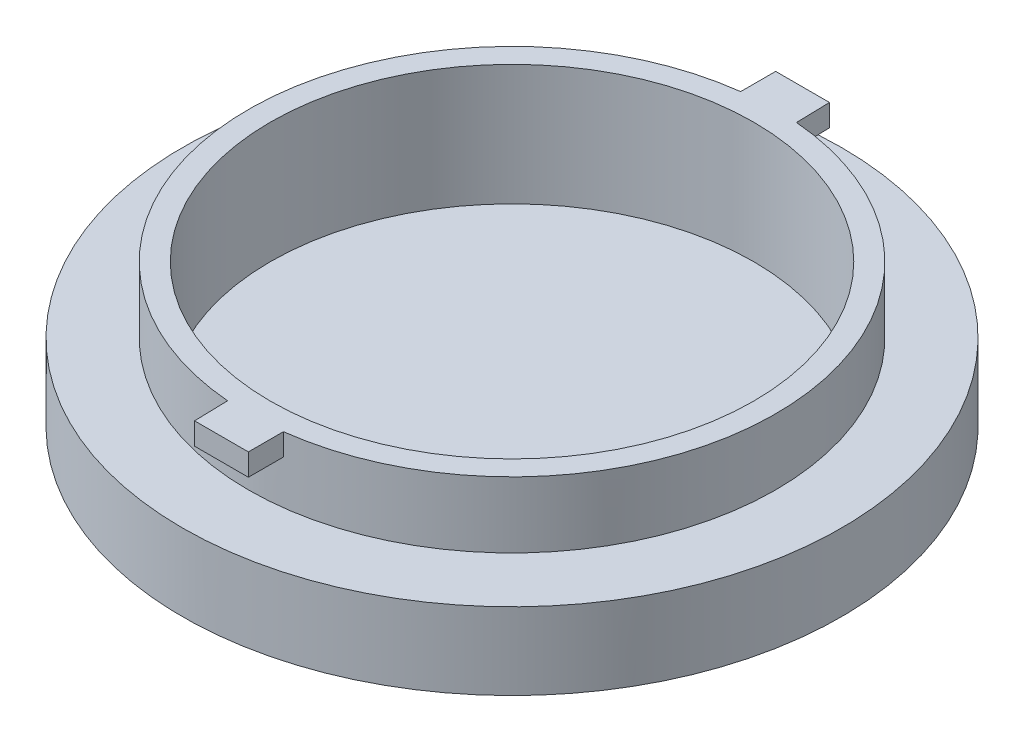
from build123d import *

# Parameters (mm, degrees)
SKETCH1_R           = 30
BOSS_EXTRUDE1_DEPTH = 10
SKETCH4_R           = 24
BOSS_EXTRUDE2_DEPTH = 6
SKETCH5_R           = 22
CUT_EXTRUDE2_DEPTH  = 11
BOSS_EXTRUDE5_DEPTH = 2
SKETCH10_R          = 30
CUT_EXTRUDE3_DEPTH  = 3


with BuildPart() as part:
    # Sketch1 → Boss-Extrude1 (new body)
    with BuildSketch(Plane(origin=(0, 0, 0), x_dir=(1, 0, 0), z_dir=(0, 1, 0))):
        with Locations(Location((0, 0, 0), (0, 0, 270))):
            Circle(SKETCH1_R)
    extrude(amount=BOSS_EXTRUDE1_DEPTH)

    # Sketch4 → Boss-Extrude2 (add)
    with BuildSketch(Plane(origin=(0, 10, 0), x_dir=(1, 0, 0), z_dir=(0, 1, 0))):
        with Locations(Location((0, 0, 0), (0, 0, 270))):
            Circle(SKETCH4_R)
    extrude(amount=BOSS_EXTRUDE2_DEPTH)

    # Sketch5 → Cut-Extrude2 (cut)
    with BuildSketch(Plane(origin=(0, 16, 0), x_dir=(1, 0, 0), z_dir=(0, 1, 0))):
        with Locations(Location((0, 0, 0), (0, 0, 270))):
            Circle(SKETCH5_R)
    extrude(amount=-CUT_EXTRUDE2_DEPTH, mode=Mode.SUBTRACT)

    # Sketch9 → Boss-Extrude5 (add)
    with BuildSketch(Plane(origin=(0, 16, 0), x_dir=(1, 0, 0), z_dir=(0, 1, 0))):
        Polygon((0.5, -23), (-2, -23), (-1.900803743, -27), (3, -27), (3, -23), align=None)
        Polygon((-3, 23), (-3, 27), (1.900803743, 27), (2, 23), (-0.5, 23), align=None)
    extrude(amount=-BOSS_EXTRUDE5_DEPTH)

    # Sketch10 → Cut-Extrude3 (cut)
    with BuildSketch(Plane.XZ):
        with Locations(Location((0, 0, 0), (0, 0, 270))):
            Circle(SKETCH10_R)
    extrude(amount=-CUT_EXTRUDE3_DEPTH, mode=Mode.SUBTRACT)


solid = part.part
